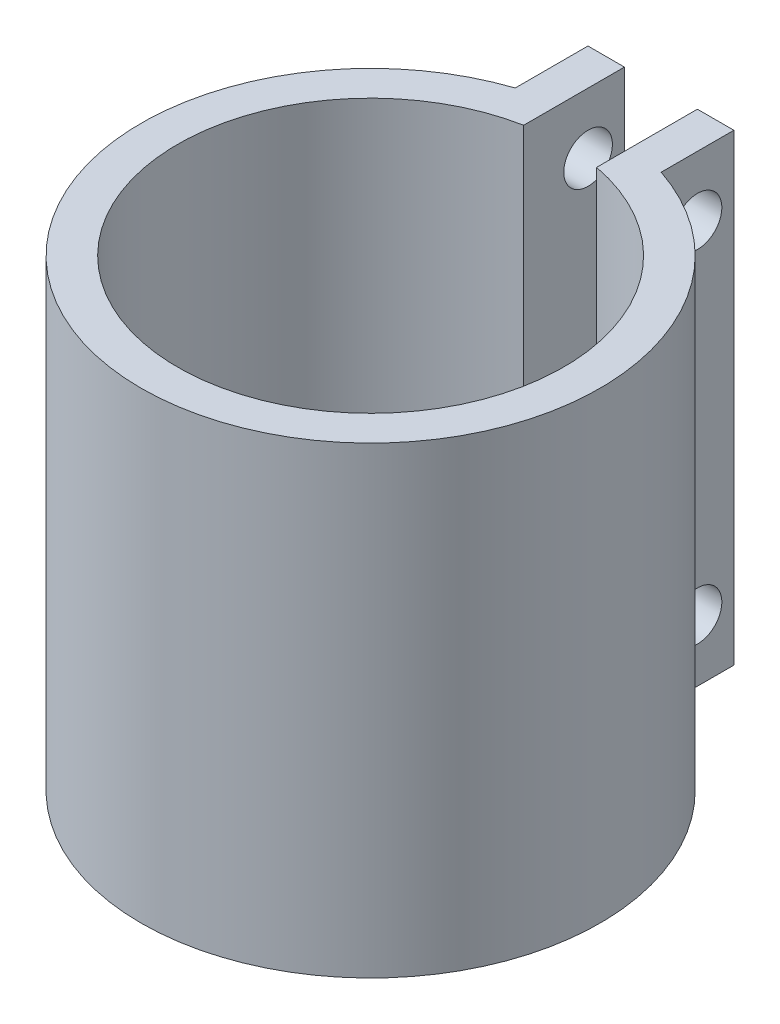
from build123d import *

# Parameters (mm, degrees)
BOSS_EXTRUDE1_DEPTH = 38.1
SKETCH2_R           = 2
CUT_EXTRUDE1_DEPTH  = 52.38473752


with BuildPart() as part:
    # Sketch1 → Boss-Extrude1 (new body)
    with BuildSketch(Plane(origin=(0, 0, 0), x_dir=(1, 0, 0), z_dir=(0, 1, 0))):
        with BuildLine():
            Line((3, 15.875), (3, 23.875))
            Line((3, 23.875), (6, 23.875))
            Line((6, 23.875), (6, 17.895966724))
            ThreePointArc((6, 17.895966724), (0, -18.875), (-6, 17.895966724))
            Line((-6, 17.895966724), (-6, 23.875))
            Line((-6, 23.875), (-3, 23.875))
            Line((-3, 23.875), (-3, 15.875))
            Line((-3, 15.875), (-3, 15.588958432))
            ThreePointArc((-3, 15.588958432), (0, -15.875), (3, 15.588958432))
            Line((3, 15.588958432), (3, 15.875))
        make_face()
    extrude(amount=BOSS_EXTRUDE1_DEPTH)

    # Sketch2 → Cut-Extrude1 (cut, through all)
    with BuildSketch(Plane.ZY.offset(6)):
        with Locations((-20.885483362, 33.1)):
            Circle(SKETCH2_R)
        with Locations((-20.885483362, 5)):
            Circle(SKETCH2_R)
    extrude(amount=-CUT_EXTRUDE1_DEPTH, mode=Mode.SUBTRACT)


solid = part.part
